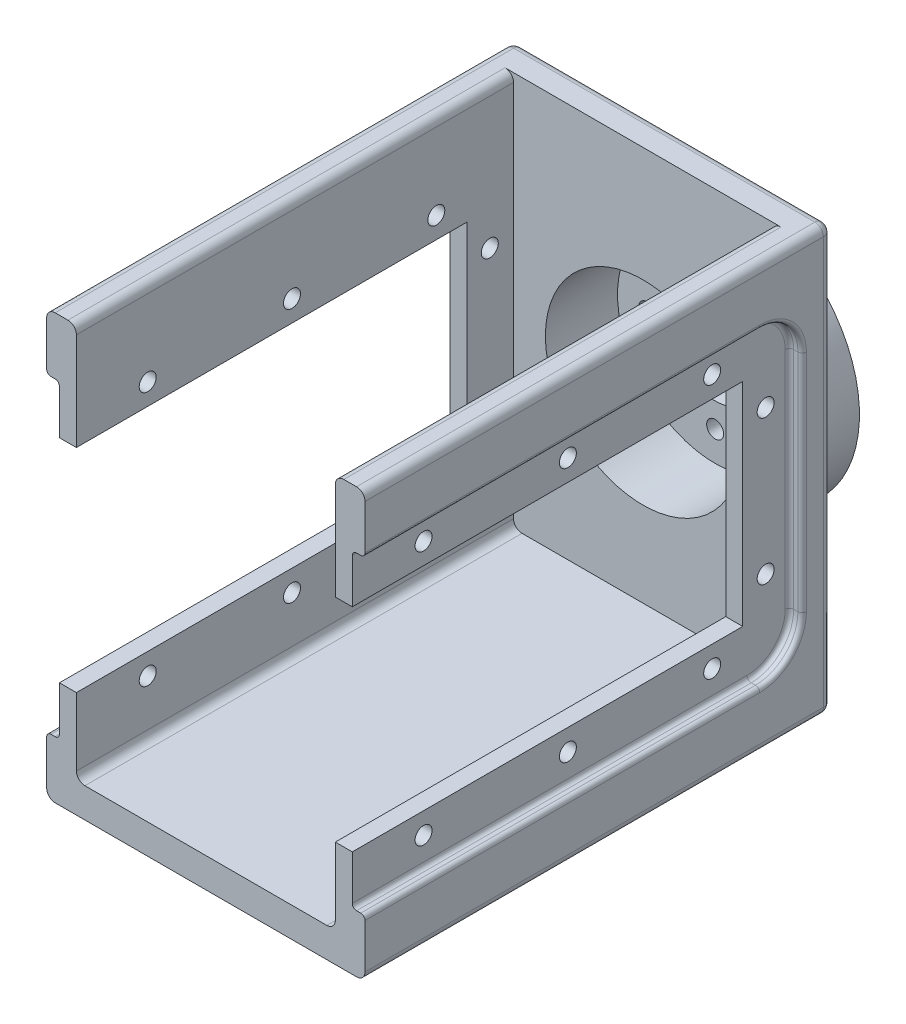
from build123d import *

# Parameters (mm, degrees)
SKETCH1_W               = 37.5
SKETCH1_H               = 50
BOSS_EXTRUDE1_DEPTH     = 55
SKETCH3_R               = 15
BOSS_EXTRUDE2_DEPTH     = 7
SHELL1_T                = -3.5
SKETCH4_R               = 5.121522354
CUT_EXTRUDE1_DEPTH      = 7
CUT_EXTRUDE2_DEPTH      = 72.107313267
CUT_EXTRUDE2_DEPTH_BACK = 72.107313267
SKETCH5_W               = 46
SKETCH5_H               = 25
TAP_DRILL_FOR_M2_TAP1_D = 2
CUT_EXTRUDE4_DEPTH      = 1.5
FILLET1_R               = 1
FILLET2_R               = 0.5
SKETCH11_R              = 11.5
CUT_EXTRUDE5_DEPTH      = 1.5
F_1_0MM_DOWEL_HOLE1_D   = 2


with BuildPart() as part:
    # Sketch1 → Boss-Extrude1 (new body)
    with BuildSketch(Plane.XY):
        Rectangle(SKETCH1_W, SKETCH1_H)
    extrude(amount=BOSS_EXTRUDE1_DEPTH)

    # Sketch3 → Boss-Extrude2 (add)
    with BuildSketch(Plane(origin=(0, 0, 0), x_dir=(-1, 0, 0), z_dir=(0, 0, -1))):
        Circle(SKETCH3_R)
    extrude(amount=BOSS_EXTRUDE2_DEPTH)

    # Shell1
    shell1_openings = [part.faces().sort_by_distance(p)[0] for p in [
        (0, 0, 55),
        (0, 25, 27.5),
    ]]
    offset(amount=SHELL1_T, openings=shell1_openings, kind=Kind.INTERSECTION)

    # Sketch4 → Cut-Extrude1 (cut)
    with BuildSketch(Plane.XY.offset(-3.5)):
        Circle(SKETCH4_R)
    extrude(amount=-CUT_EXTRUDE1_DEPTH, mode=Mode.SUBTRACT)

    # Sketch5 → Cut-Extrude2 (cut, two sides: drawn at the far end of the back side and taken through both)
    with BuildSketch(Plane.ZY.offset(18.75).offset(-CUT_EXTRUDE2_DEPTH_BACK)):
        with Locations((32, 0)):
            Rectangle(SKETCH5_W, SKETCH5_H)
    extrude(amount=CUT_EXTRUDE2_DEPTH + CUT_EXTRUDE2_DEPTH_BACK, mode=Mode.SUBTRACT)

    # Tap Drill for M2 Tap1 (through all)
    with Locations(Plane(origin=(18.75, 15, 46.6), x_dir=(0, 1, 0), z_dir=(1, 0, 0))):
        with Locations((0, 0), (0, -17), (-30, 0), (-30, -17), (-30, -34), (-23.5, -40.3), (-6.5, -40.3), (0, -34)):
            Hole(TAP_DRILL_FOR_M2_TAP1_D / 2)

    # Sketch10 → Cut-Extrude4 (cut)
    with BuildSketch(Plane(origin=(18.75, 0, 0), x_dir=(0, 0, -1), z_dir=(1, 0, 0))):
        with BuildLine():
            Line((-55, -18.25), (-8.5, -18.25))
            ThreePointArc((-8.5, -18.25), (-4.964466094, -16.785533906), (-3.5, -13.25))
            Line((-3.5, -13.25), (-3.5, 13.25))
            ThreePointArc((-3.5, 13.25), (-4.964466094, 16.785533906), (-8.5, 18.25))
            Line((-8.5, 18.25), (-55, 18.25))
            Line((-55, 18.25), (-55, -18.25))
        make_face()
    cut_extrude4 = extrude(amount=-CUT_EXTRUDE4_DEPTH, mode=Mode.SUBTRACT)

    # Mirror1: Cut-Extrude4 across plane
    add(cut_extrude4.mirror(Plane(origin=(0, 0, 0), x_dir=(0, 0, 1), z_dir=(1, 0, 0))), mode=Mode.SUBTRACT)

    # Fillet1
    fillet1_edges = [part.edges().sort_by_distance(p)[0] for p in [
        (15, 0, 0),
        (15.25, -21.5, 29.25),
        (15.25, 25, 29.25),
        (-15.25, 25, 29.25),
        (-15.25, -21.5, 29.25),
        (0, -25, 0),
        (-18.75, 0, 0),
        (0, 25, 0),
        (18.75, 0, 0),
        (18.75, -25, 27.5),
        (-18.75, -25, 27.5),
        (-18.75, 25, 27.5),
        (18.75, 25, 27.5),
    ]]
    fillet(fillet1_edges, radius=FILLET1_R)

    # Fillet2
    fillet2_edges = [part.edges().sort_by_distance(p)[0] for p in [
        (18.75, -18.25, 31.75),
        (18.75, -16.785533906, 4.964466094),
        (18.75, 0, 3.5),
        (18.75, 16.785533906, 4.964466094),
        (18.75, 18.25, 31.75),
        (17.25, 18.25, 31.75),
        (17.25, 16.785533906, 4.964466094),
        (17.25, 0, 3.5),
        (17.25, -16.785533906, 4.964466094),
        (17.25, -18.25, 31.75),
        (-17.25, -18.25, 31.75),
        (-17.25, -16.785533906, 4.964466094),
        (-17.25, 0, 3.5),
        (-17.25, 16.785533906, 4.964466094),
        (-17.25, 18.25, 31.75),
        (-18.75, -18.25, 31.75),
        (-18.75, -16.785533906, 4.964466094),
        (-18.75, 0, 3.5),
        (-18.75, 16.785533906, 4.964466094),
        (-18.75, 18.25, 31.75),
    ]]
    fillet(fillet2_edges, radius=FILLET2_R)

    # Sketch11 → Cut-Extrude5 (cut)
    with BuildSketch(Plane.XY.offset(-3.5)):
        Circle(SKETCH11_R)
    extrude(amount=-CUT_EXTRUDE5_DEPTH, mode=Mode.SUBTRACT)

    # Ø1.0mm Dowel Hole1 (through all)
    with Locations(Plane(origin=(5.656854249, 5.656854249, -5), x_dir=(1, 0, 0), z_dir=(0, 0, 1))):
        with Locations((0, 0), (-5.656854249, 2.343145751), (2.343145751, -5.656854249), (0, -11.313708498), (-5.656854249, -13.656854249), (-11.313708498, -11.313708498), (-13.656854249, -5.656854249), (-11.313708498, 0)):
            Hole(F_1_0MM_DOWEL_HOLE1_D / 2)


solid = part.part
